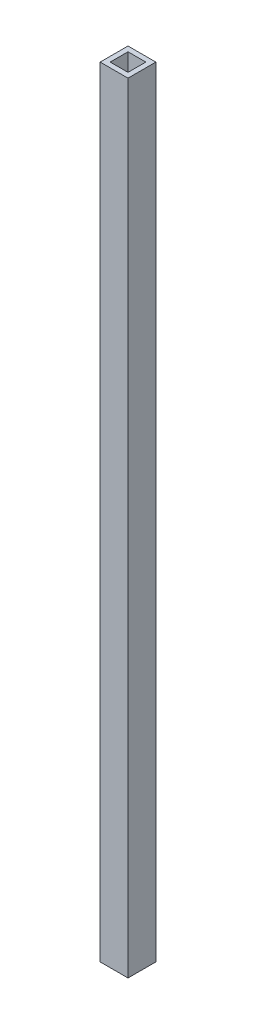
from build123d import *

# Parameters (mm, degrees)
SKETCH_1_W      = 10
SKETCH_1_H      = 10
SKETCH_1_W_2    = 6.4
SKETCH_1_H_2    = 6.4
EXTRUDE_1_DEPTH = 280


with BuildPart() as part:
    # 草图1 → 凸台-拉伸1 (new body)
    with BuildSketch(Plane(origin=(0, 0, 0), x_dir=(1, 0, 0), z_dir=(0, 1, 0))):
        Rectangle(SKETCH_1_W, SKETCH_1_H)
        Rectangle(SKETCH_1_W_2, SKETCH_1_H_2, mode=Mode.SUBTRACT)
    extrude(amount=EXTRUDE_1_DEPTH)


solid = part.part
